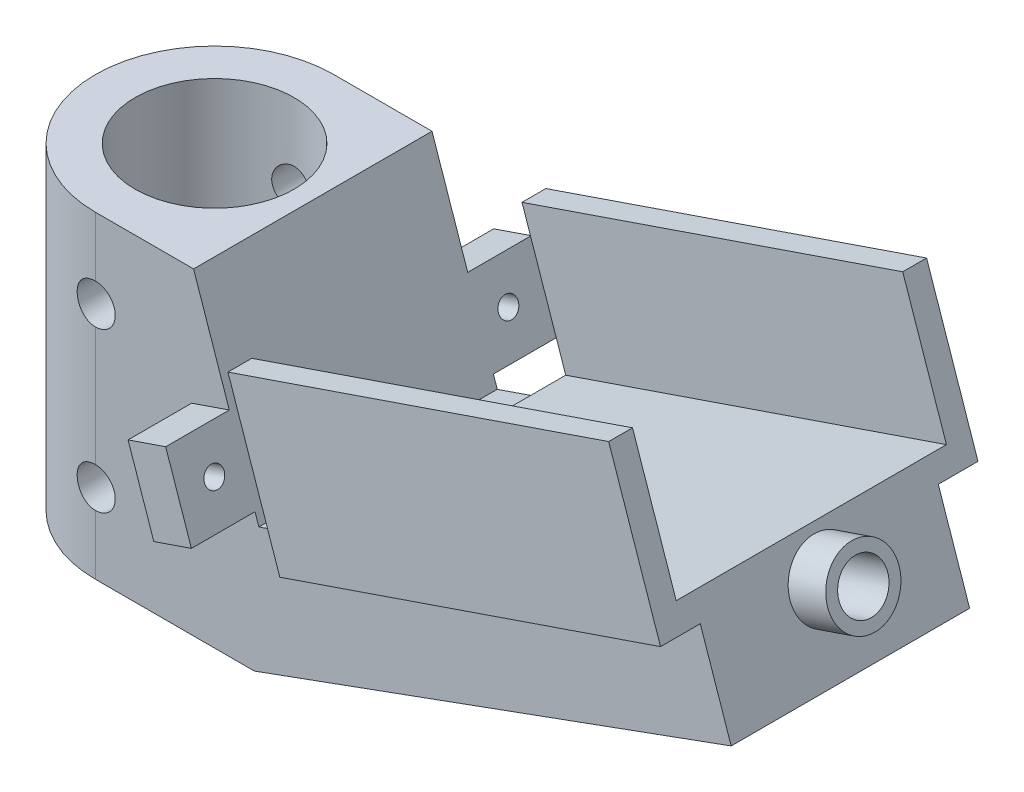
from build123d import *

# Parameters (mm, degrees)
ESQUISSE1_R                  = 10
BOSS_EXTRU_1_DEPTH           = 40
ENL_V_MAT_EXTRU_1_DEPTH      = 95.339811321
ENL_V_MAT_EXTRU_2_DEPTH      = 95.339811321
ESQUISSE5_R                  = 3.075
ENL_V_MAT_EXTRU_3_DEPTH      = 50
ENL_V_MAT_EXTRU_4_DEPTH      = 95.339811321
TROU_TARAUD_M31_REACH        = 93.715
TROU_TARAUD_M31_BORE_R       = 1.25
BOSS_EXTRU_2_DEPTH           = 8
BOSS_EXTRU_3_DEPTH           = 8
ESQUISSE19_W                 = 7.5
ESQUISSE19_H                 = 30
ENL_V_MAT_EXTRU_5_DEPTH      = 1.5
BOSS_EXTRU_4_DEPTH           = 5
BOSS_EXTRU_5_DEPTH           = 5
ESQUISSE36_W                 = 50.627353798
ESQUISSE36_H                 = 3
BOSS_EXTRU_6_DEPTH           = 17
TROU_TARAUD_M35_D            = 2.5
TROU_TARAUD_M35_DEPTH        = 5
ESQUISSE40_R                 = 4.5
BOSS_EXTRU_8_DEPTH           = 5
ESQUISSE41_R                 = 3.075
ENL_V_MAT_EXTRU_7_DEPTH      = 5
ENL_V_MAT_EXTRU_8_DEPTH      = 101.831047543
ENL_V_MAT_EXTRU_8_DEPTH_BACK = 101.831047543
ESQUISSE42_R                 = 2.5


with BuildPart() as part:
    # Esquisse1 → Boss.-Extru.1 (new body)
    with BuildSketch(Plane(origin=(0, 0, 0), x_dir=(1, 0, 0), z_dir=(0, 1, 0))):
        with BuildLine():
            Line((0, -15), (80, -15))
            Line((80, -15), (80, 15))
            Line((80, 15), (0, 15))
            ThreePointArc((0, 15), (-15, 0), (0, -15))
        make_face()
        with Locations(Location((0, 0, 0), (0, 0, 270))):
            Circle(ESQUISSE1_R, mode=Mode.SUBTRACT)
    extrude(amount=BOSS_EXTRU_1_DEPTH)

    # Esquisse3 → Enlèv. mat.-Extru.1 (cut, through all)
    with BuildSketch(Plane.XY.offset(15)):
        Polygon((20, 0), (80, 0), (80, 21.8382), align=None)
    extrude(amount=-ENL_V_MAT_EXTRU_1_DEPTH, mode=Mode.SUBTRACT)

    # Esquisse4 → Enlèv. mat.-Extru.2 (cut, through all)
    with BuildSketch(Plane.XY.offset(15)):
        Polygon((80, 21.8382), (80, 40), (73.7889, 40), align=None)
    extrude(amount=-ENL_V_MAT_EXTRU_2_DEPTH, mode=Mode.SUBTRACT)

    # Esquisse5 → Enlèv. mat.-Extru.3 (cut)
    with BuildSketch(Plane(origin=(78.309664358, 26.780889355, 0), x_dir=(0, 0, -1), z_dir=(0.9461982424164683, 0.32358752455554646, 0))):
        with Locations(Location((0, 4.37351335, 0), (0, 0, 90))):
            Circle(ESQUISSE5_R)
    extrude(amount=-ENL_V_MAT_EXTRU_3_DEPTH, mode=Mode.SUBTRACT)

    # Esquisse6 → Enlèv. mat.-Extru.4 (cut, through all)
    with BuildSketch(Plane.XY.offset(15)):
        Polygon((75.083250098, 36.21520703), (20.083250098, 17.405920506), (12.356368008, 40), (73.7889, 40), align=None)
    extrude(amount=-ENL_V_MAT_EXTRU_4_DEPTH, mode=Mode.SUBTRACT)

    # Trou taraudé M31 bore → Trou taraudé M31 (cut, up to next)
    with BuildSketch(Plane(origin=(2.339552909, -6.427872928, 0), x_dir=(-0.9396926915369543, -0.3420199489387053, 0), z_dir=(0.3420199489387053, -0.9396926915369543, 0)), mode=Mode.PRIVATE) as trou_taraud_m31_sk1:
        with Locations((-46.885275043, 0)):
            Circle(TROU_TARAUD_M31_BORE_R)
    trou_taraud_m31_tool1 = extrude(trou_taraud_m31_sk1.sketch, amount=-TROU_TARAUD_M31_REACH, mode=Mode.PRIVATE) & part.part
    # Trou taraudé M31 bore → Trou taraudé M31 (cut, up to next)
    with BuildSketch(Plane(origin=(2.339552909, -6.427872928, 0), x_dir=(-0.9396926915369543, -0.3420199489387053, 0), z_dir=(0.3420199489387053, -0.9396926915369543, 0)), mode=Mode.PRIVATE) as trou_taraud_m31_sk2:
        with Locations((-70.089378087, 0)):
            Circle(TROU_TARAUD_M31_BORE_R)
    trou_taraud_m31_tool2 = extrude(trou_taraud_m31_sk2.sketch, amount=-TROU_TARAUD_M31_REACH, mode=Mode.PRIVATE) & part.part
    add(trou_taraud_m31_tool1.solids().sort_by_distance((46.397303, 9.607826, 0))[0], mode=Mode.SUBTRACT)
    add(trou_taraud_m31_tool2.solids().sort_by_distance((68.202029, 17.544093, 0))[0], mode=Mode.SUBTRACT)

    # Esquisse11 → Boss.-Extru.2 (add)
    with BuildSketch(Plane.XY.offset(15)):
        Polygon((20.083250098, 17.405920506), (16.847374853, 26.86790293), (12.116383641, 25.249965307), (15.352258886, 15.787982883), align=None)
    extrude(amount=BOSS_EXTRU_2_DEPTH)

    # Esquisse12 → Boss.-Extru.3 (add)
    with BuildSketch(Plane(origin=(0, 0, -15), x_dir=(-1, 0, 0), z_dir=(0, 0, -1))):
        Polygon((-20.083250098, 17.405920506), (-16.847374853, 26.86790293), (-12.116383641, 25.249965307), (-15.352258886, 15.787982883), align=None)
    extrude(amount=BOSS_EXTRU_3_DEPTH)

    # Esquisse19 → Enlèv. mat.-Extru.5 (cut)
    with BuildSketch(Plane(origin=(-3.22641426, 9.434317675, 0), x_dir=(0.9461982424164682, 0.3235875245555466, 0), z_dir=(-0.3235875245555466, 0.9461982424164682, 0))):
        with Locations((28.385074674, 0)):
            Rectangle(ESQUISSE19_W, ESQUISSE19_H)
    extrude(amount=-ENL_V_MAT_EXTRU_5_DEPTH, mode=Mode.SUBTRACT)

    # Esquisse34 → Boss.-Extru.4 (add)
    with BuildSketch(Plane.XY.offset(15)):
        Polygon((27.179736916, 19.83282694), (75.083250098, 36.21520703), (76.109211181, 33.21520703), (28.205697999, 16.83282694), align=None)
    extrude(amount=BOSS_EXTRU_4_DEPTH)

    # Esquisse35 → Boss.-Extru.5 (add)
    with BuildSketch(Plane(origin=(0, 0, -15), x_dir=(-1, 0, 0), z_dir=(0, 0, -1))):
        Polygon((-27.179736916, 19.83282694), (-75.083250098, 36.21520703), (-76.054012672, 33.376612303), (-28.15049949, 16.994232213), align=None)
    extrude(amount=BOSS_EXTRU_5_DEPTH)

    # Esquisse36 → Boss.-Extru.6 (add)
    with BuildSketch(Plane(origin=(-3.22641426, 9.434317675, 0), x_dir=(0.9461982424164682, 0.3235875245555466, 0), z_dir=(-0.3235875245555466, 0.9461982424164682, 0))):
        with Locations((57.448751573, -18.5)):
            Rectangle(ESQUISSE36_W, ESQUISSE36_H)
        with Locations((57.448751573, 18.5)):
            Rectangle(ESQUISSE36_W, ESQUISSE36_H)
    extrude(amount=BOSS_EXTRU_6_DEPTH)

    # Trou taraudé M35
    with Locations(Plane(origin=(23.309664358, 7.971602831, 0), x_dir=(0, 0, -1), z_dir=(0.9461982424164682, 0.3235875245555468, 0))):
        with Locations((-18.5, 14.970762206), (18.5, 14.970762206)):
            Hole(TROU_TARAUD_M35_D / 2, depth=TROU_TARAUD_M35_DEPTH)

    # Esquisse40 → Boss.-Extru.8 (add)
    with BuildSketch(Plane(origin=(78.309664358, 26.780889355, 0), x_dir=(0, 0, -1), z_dir=(0.9461982424164683, 0.32358752455554646, 0))):
        with Locations(Location((0, 4.37351335, 0), (0, 0, 270))):
            Circle(ESQUISSE40_R)
    extrude(amount=BOSS_EXTRU_8_DEPTH)

    # Esquisse41 → Enlèv. mat.-Extru.7 (cut)
    with BuildSketch(Plane(origin=(83.04065557, 28.398826978, 0), x_dir=(0, 0, -1), z_dir=(0.9461982424164683, 0.32358752455554646, 0))):
        with Locations(Location((0, 4.37351335, 0), (0, 0, 90))):
            Circle(ESQUISSE41_R)
    extrude(amount=-ENL_V_MAT_EXTRU_7_DEPTH, mode=Mode.SUBTRACT)

    # Esquisse42 → Enlèv. mat.-Extru.8 (cut, two sides: drawn at the far end of the back side and taken through both)
    with BuildSketch(Plane.XY.offset(-ENL_V_MAT_EXTRU_8_DEPTH_BACK)):
        with Locations(Location((0, 30, 0), (0, 0, 90.000000004))):
            Circle(ESQUISSE42_R)
        with Locations(Location((0, 10, 0), (0, 0, 90.000000004))):
            Circle(ESQUISSE42_R)
    extrude(amount=ENL_V_MAT_EXTRU_8_DEPTH + ENL_V_MAT_EXTRU_8_DEPTH_BACK, mode=Mode.SUBTRACT)


solid = part.part
